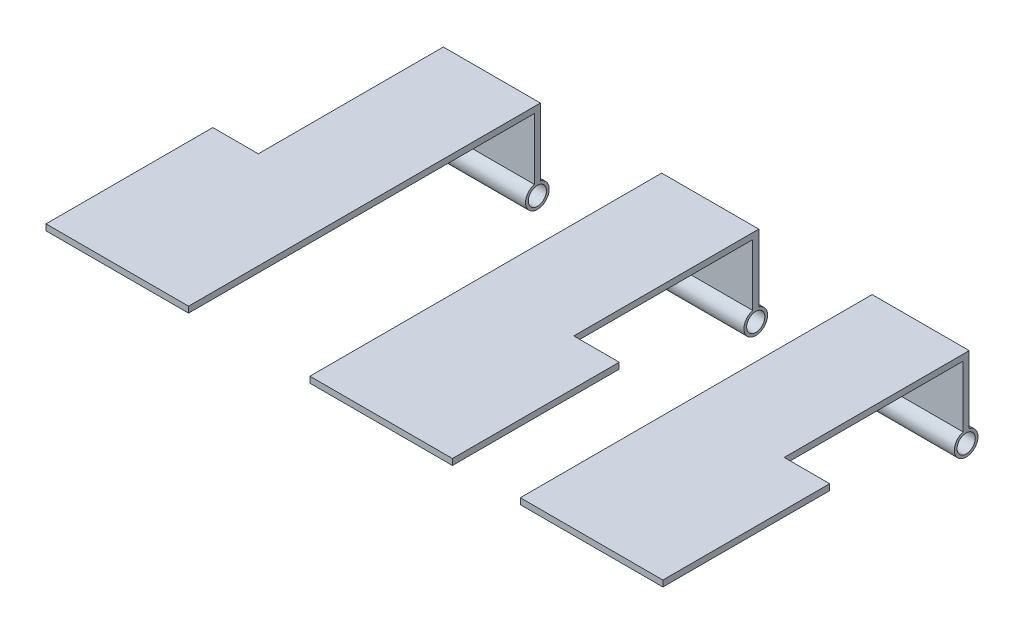
from build123d import *

# Parameters (mm, degrees)
SKETCH1_R           = 1.5
BOSS_EXTRUDE1_DEPTH = 16
BOSS_EXTRUDE2_DEPTH = 1


with BuildPart() as part:
    # Sketch1 → Boss-Extrude1 (new body)
    with BuildSketch(Plane(origin=(0, 0, 0), x_dir=(0, 0, -1), z_dir=(1, 0, 0))):
        with BuildLine():
            Line((0.49946551, 13), (-0.50053449, 13))
            Line((-0.50053449, 13), (-0.50053449, 1.884665812))
            ThreePointArc((-0.50053449, 1.884665812), (0.000552977, -1.949999922), (0.49946551, 1.88494939))
            Line((0.49946551, 1.88494939), (0.49946551, 13))
        make_face()
        Circle(SKETCH1_R, mode=Mode.SUBTRACT)
    extrude(amount=BOSS_EXTRUDE1_DEPTH)

    # Sketch2 → Boss-Extrude2 (add)
    with BuildSketch(Plane(origin=(0, 13, 0), x_dir=(1, 0, 0), z_dir=(0, 1, 0))):
        Polygon((0, 0), (0, -57.5), (23.5, -57.5), (23.5, -30.00053449), (16, -30.00053449), (16, -0.00053449), align=None)
    extrude(amount=-BOSS_EXTRUDE2_DEPTH)


with BuildPart() as body_2:
    # Body-Move/Copy2: copy of part
    add(part.part.moved(Location((-34.690892156, 0, 0))))


with BuildPart() as body_3:
    # Mirror4: mirrored copy
    add(body_2.part.mirror(Plane.ZY.offset(44.690892156)))


solid = Compound([part.part, body_2.part, body_3.part])
